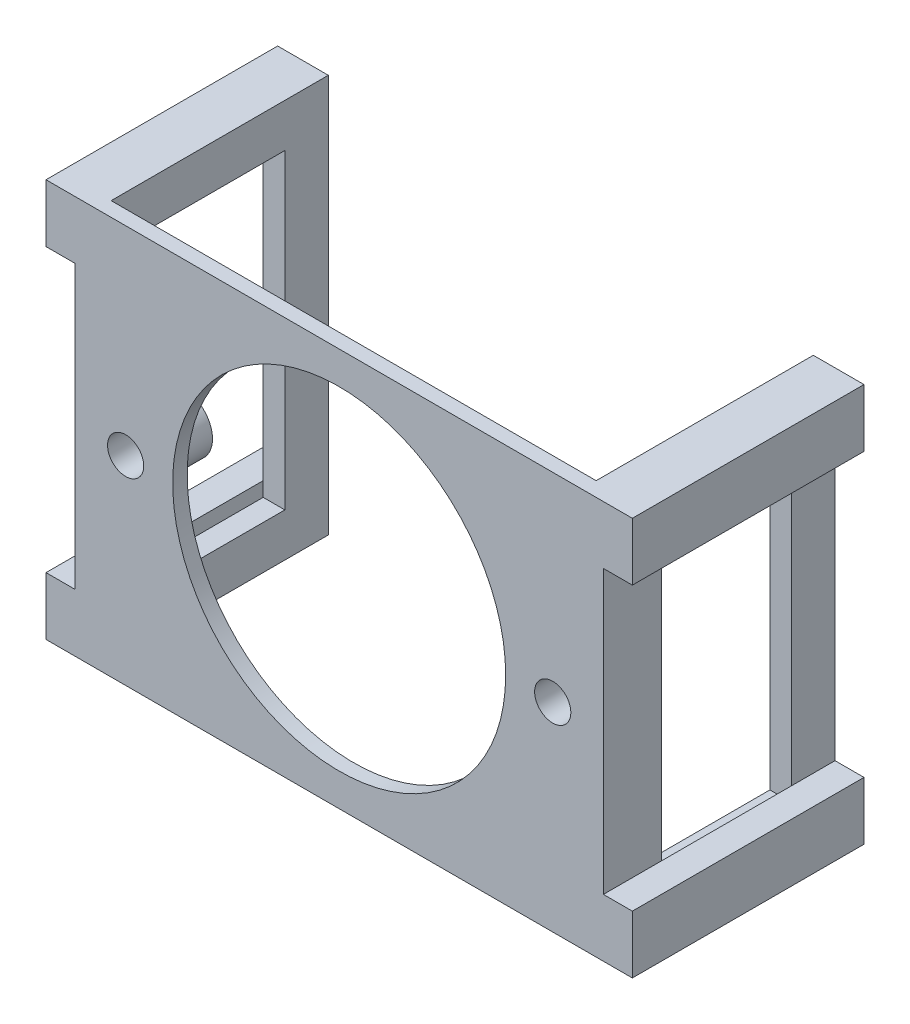
from build123d import *

# Parameters (mm, degrees)
SKETCH2_W           = 36.5
SKETCH2_H           = 27.5
SKETCH2_R           = 11.5
SKETCH2_R_2         = 1.25
BOSS_EXTRUDE1_DEPTH = 1
SKETCH4_R           = 1.25
BOSS_EXTRUDE2_DEPTH = 3
SKETCH5_W           = 1.5
SKETCH5_H           = 27.5
BOSS_EXTRUDE3_DEPTH = 12
SKETCH6_W           = 9
SKETCH6_H           = 21.5
CUT_EXTRUDE1_DEPTH  = 1.5
BOSS_EXTRUDE4_REACH = 29.895
SKETCH7_W           = 2
SKETCH7_H           = 4


with BuildPart() as part:
    # Sketch2 → Boss-Extrude1 (new body)
    with BuildSketch(Plane.XY):
        Rectangle(SKETCH2_W, SKETCH2_H)
        Circle(SKETCH2_R, mode=Mode.SUBTRACT)
        with Locations((-14.75, 0)):
            Circle(SKETCH2_R_2, mode=Mode.SUBTRACT)
        with Locations((14.75, 0)):
            Circle(SKETCH2_R_2, mode=Mode.SUBTRACT)
    extrude(amount=-BOSS_EXTRUDE1_DEPTH)

    # Sketch4 → Boss-Extrude2 (add)
    with BuildSketch(Plane(origin=(0, 0, -1), x_dir=(-1, 0, 0), z_dir=(0, 0, -1))):
        with BuildLine():
            Line((-16.75, 4), (-16.75, 13.75))
            Line((-16.75, 13.75), (-18.25, 13.75))
            Line((-18.25, 13.75), (-18.25, -13.75))
            Line((-18.25, -13.75), (-16.75, -13.75))
            Line((-16.75, -13.75), (-16.75, -4))
            ThreePointArc((-16.75, -4), (-16.164213562, -2.585786438), (-14.75, -2))
            ThreePointArc((-14.75, -2), (-12.75, 0), (-14.75, 2))
            ThreePointArc((-14.75, 2), (-16.164213562, 2.585786438), (-16.75, 4))
        make_face()
        with Locations((-14.75, 0)):
            Circle(SKETCH4_R, mode=Mode.SUBTRACT)
    boss_extrude2 = extrude(amount=BOSS_EXTRUDE2_DEPTH)

    # Sketch5 → Boss-Extrude3 (add)
    with BuildSketch(Plane(origin=(0, 0, -4), x_dir=(-1, 0, 0), z_dir=(0, 0, -1))):
        with Locations((-17.5, 0)):
            Rectangle(SKETCH5_W, SKETCH5_H)
    boss_extrude3 = extrude(amount=BOSS_EXTRUDE3_DEPTH)

    # Sketch6 → Cut-Extrude1 (cut)
    with BuildSketch(Plane(origin=(18.25, 0, 0), x_dir=(0, 0, -1), z_dir=(1, 0, 0))):
        with Locations((8.5, 0)):
            Rectangle(SKETCH6_W, SKETCH6_H)
    cut_extrude1 = extrude(amount=-CUT_EXTRUDE1_DEPTH, mode=Mode.SUBTRACT)

    # Boss-Extrude4: up to this face of the body (flat: up to its plane)
    boss_extrude4_end = Plane(part.part.faces().sort_by_distance((-17.792998906, 0, 0))[0])
    # Sketch7 → Boss-Extrude4 (add, up to the picked face)
    with BuildSketch(Plane(origin=(0, 0, -16), x_dir=(-1, 0, 0), z_dir=(0, 0, -1)), mode=Mode.PRIVATE) as boss_extrude4_sk1:
        with Locations((-19.25, 11.75)):
            Rectangle(SKETCH7_W, SKETCH7_H)
    boss_extrude4_tool1 = split(extrude(boss_extrude4_sk1.sketch, amount=-BOSS_EXTRUDE4_REACH, mode=Mode.PRIVATE), bisect_by=boss_extrude4_end, keep=Keep.BOTH, mode=Mode.PRIVATE)
    # Sketch7 → Boss-Extrude4 (add, up to the picked face)
    with BuildSketch(Plane(origin=(0, 0, -16), x_dir=(-1, 0, 0), z_dir=(0, 0, -1)), mode=Mode.PRIVATE) as boss_extrude4_sk2:
        with Locations((-19.25, -11.75)):
            Rectangle(SKETCH7_W, SKETCH7_H)
    boss_extrude4_tool2 = split(extrude(boss_extrude4_sk2.sketch, amount=-BOSS_EXTRUDE4_REACH, mode=Mode.PRIVATE), bisect_by=boss_extrude4_end, keep=Keep.BOTH, mode=Mode.PRIVATE)
    boss_extrude4_1 = boss_extrude4_tool1.solids().sort_by(Axis((19.25, 11.75, -16), (0, 0, 1)))[0]
    add(boss_extrude4_1)
    boss_extrude4_2 = boss_extrude4_tool2.solids().sort_by(Axis((19.25, -11.75, -16), (0, 0, 1)))[0]
    add(boss_extrude4_2)
    boss_extrude4 = boss_extrude4_1 + boss_extrude4_2  # Boss-Extrude4 as one shape, for the pattern or mirror that repeats it

    # Mirror1: Boss-Extrude2, Boss-Extrude3, Cut-Extrude1, Boss-Extrude4 across plane
    add(boss_extrude2.mirror(Plane(origin=(0, 0, 0), x_dir=(0, 0, 1), z_dir=(1, 0, 0))))
    add(boss_extrude3.mirror(Plane(origin=(0, 0, 0), x_dir=(0, 0, 1), z_dir=(1, 0, 0))))
    add(cut_extrude1.mirror(Plane(origin=(0, 0, 0), x_dir=(0, 0, 1), z_dir=(1, 0, 0))), mode=Mode.SUBTRACT)
    add(boss_extrude4.mirror(Plane(origin=(0, 0, 0), x_dir=(0, 0, 1), z_dir=(1, 0, 0))))


solid = part.part
